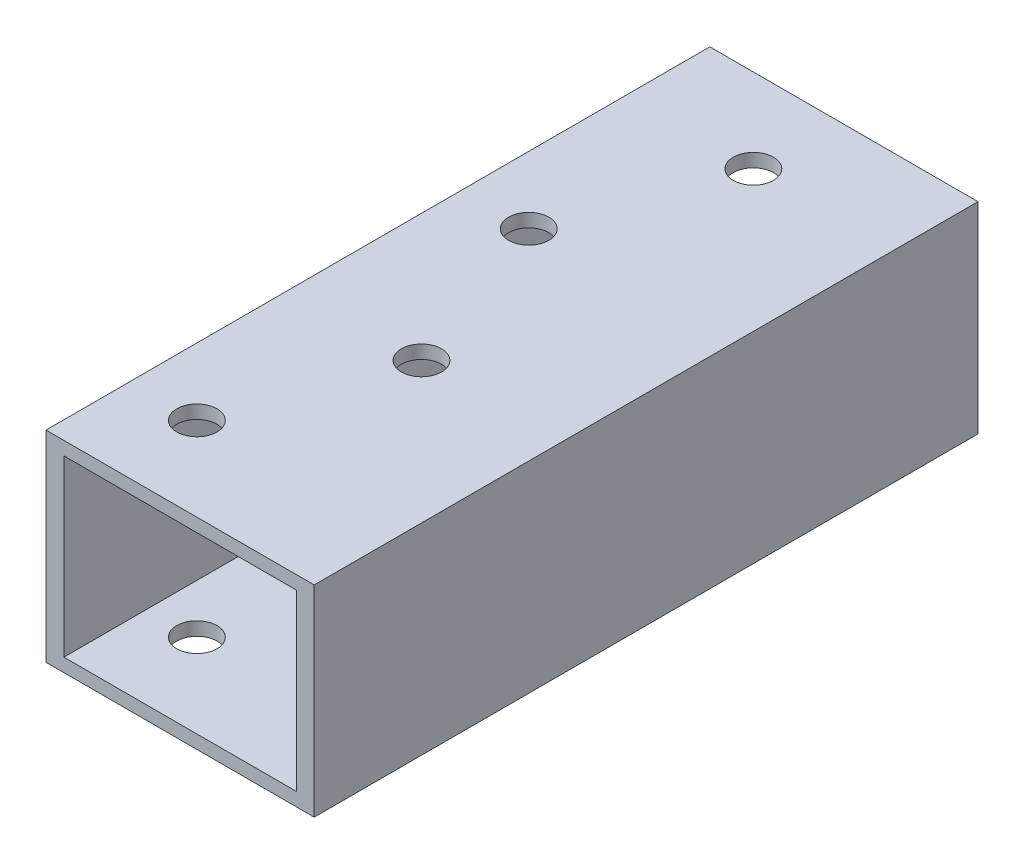
from build123d import *

# Parameters (mm, degrees)
SKETCH_1_W          = 40
SKETCH_1_H          = 30
SKETCH_1_W_2        = 34.666666666
SKETCH_1_H_2        = 26
EXTRUDE_1_DEPTH     = 99
SKETCH_3_R          = 3
CUT_EXTRUDE_1_DEPTH = 106.361283212


with BuildPart() as part:
    # 草图1 → 凸台-拉伸1 (new body)
    with BuildSketch(Plane.XY):
        Rectangle(SKETCH_1_W, SKETCH_1_H)
        Rectangle(SKETCH_1_W_2, SKETCH_1_H_2, mode=Mode.SUBTRACT)
    extrude(amount=EXTRUDE_1_DEPTH)

    # 草图3 → 切除-拉伸1 (cut, through all)
    with BuildSketch(Plane(origin=(0, 15, 0), x_dir=(1, 0, 0), z_dir=(0, 1, 0))):
        with Locations(Location((-10, -86.5, 0), (0, 0, 180))):
            Circle(SKETCH_3_R)
        with Locations(Location((-1, -62, 0), (0, 0, 180))):
            Circle(SKETCH_3_R)
        with Locations(Location((-10, -37, 0), (0, 0, 180))):
            Circle(SKETCH_3_R)
        with Locations(Location((-1, -12.5, 0), (0, 0, 180))):
            Circle(SKETCH_3_R)
    extrude(amount=-CUT_EXTRUDE_1_DEPTH, mode=Mode.SUBTRACT)


solid = part.part
